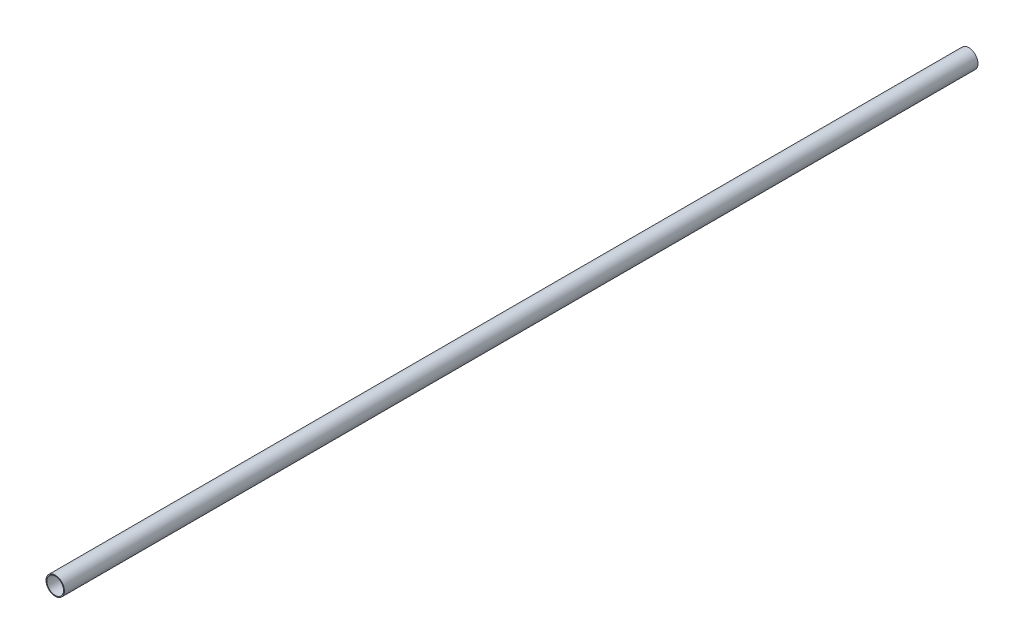
from build123d import *

# Parameters (mm, degrees)
SKETCH1_R           = 10.9601
SKETCH1_R_2         = 9.9441
BOSS_EXTRUDE1_DEPTH = 1085.85


with BuildPart() as part:
    # Sketch1 → Boss-Extrude1 (new body)
    with BuildSketch(Plane.XY):
        Circle(SKETCH1_R)
        Circle(SKETCH1_R_2, mode=Mode.SUBTRACT)
    extrude(amount=BOSS_EXTRUDE1_DEPTH)


solid = part.part
